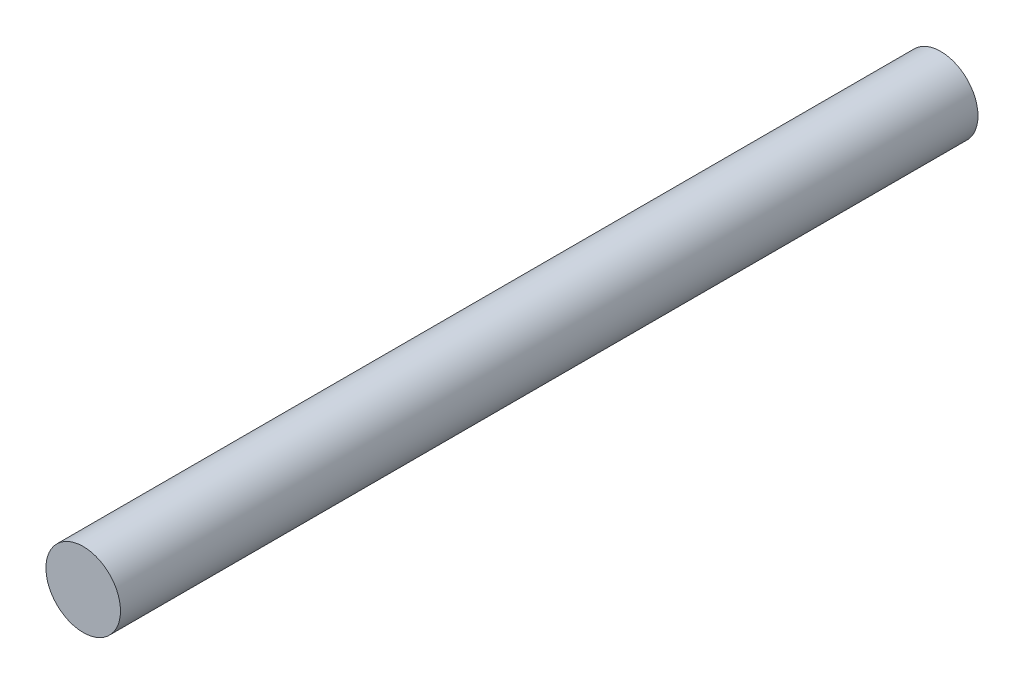
from build123d import *

# Parameters (mm, degrees)
SKETCH1_R           = 12.7
BOSS_EXTRUDE1_DEPTH = 292.1


with BuildPart() as part:
    # Sketch1 → Boss-Extrude1 (new body)
    with BuildSketch(Plane.XY):
        Circle(SKETCH1_R)
    extrude(amount=BOSS_EXTRUDE1_DEPTH)


solid = part.part
